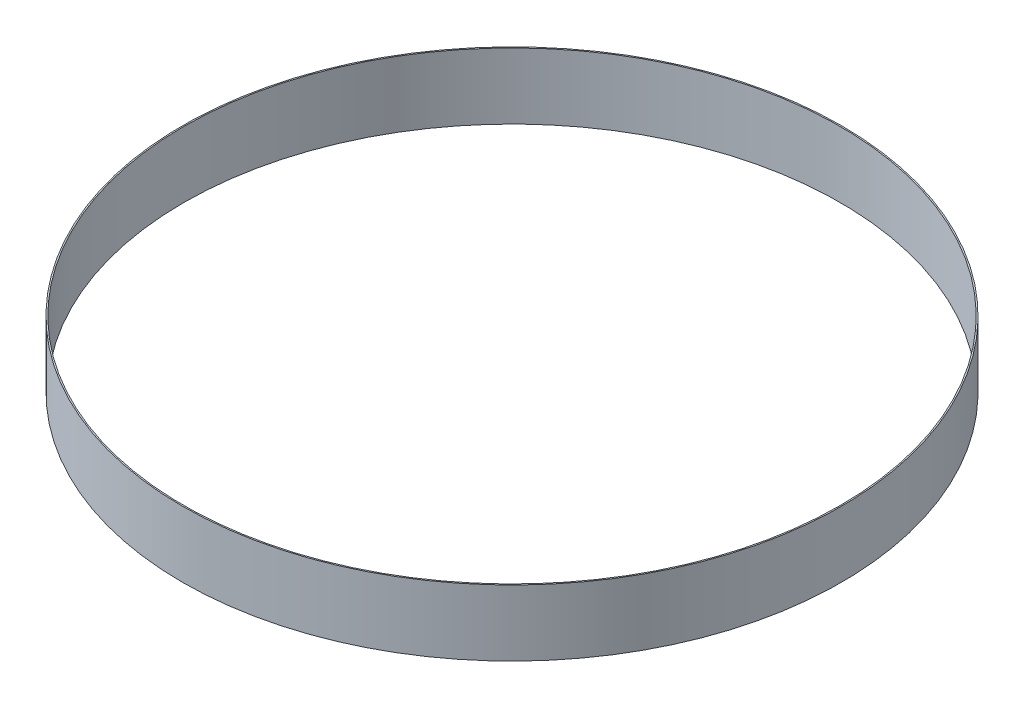
from build123d import *

# Parameters (mm, degrees)
SKETCH_1_R      = 250
SKETCH_1_R_2    = 249
EXTRUDE_1_DEPTH = 50


with BuildPart() as part:
    # Эскиз1 → Вытянуть-Тонкостенный1 (new body)
    with BuildSketch(Plane(origin=(0, 0, 0), x_dir=(1, 0, 0), z_dir=(0, 1, 0))):
        Circle(SKETCH_1_R)
        Circle(SKETCH_1_R_2, mode=Mode.SUBTRACT)
    extrude(amount=EXTRUDE_1_DEPTH)


solid = part.part
